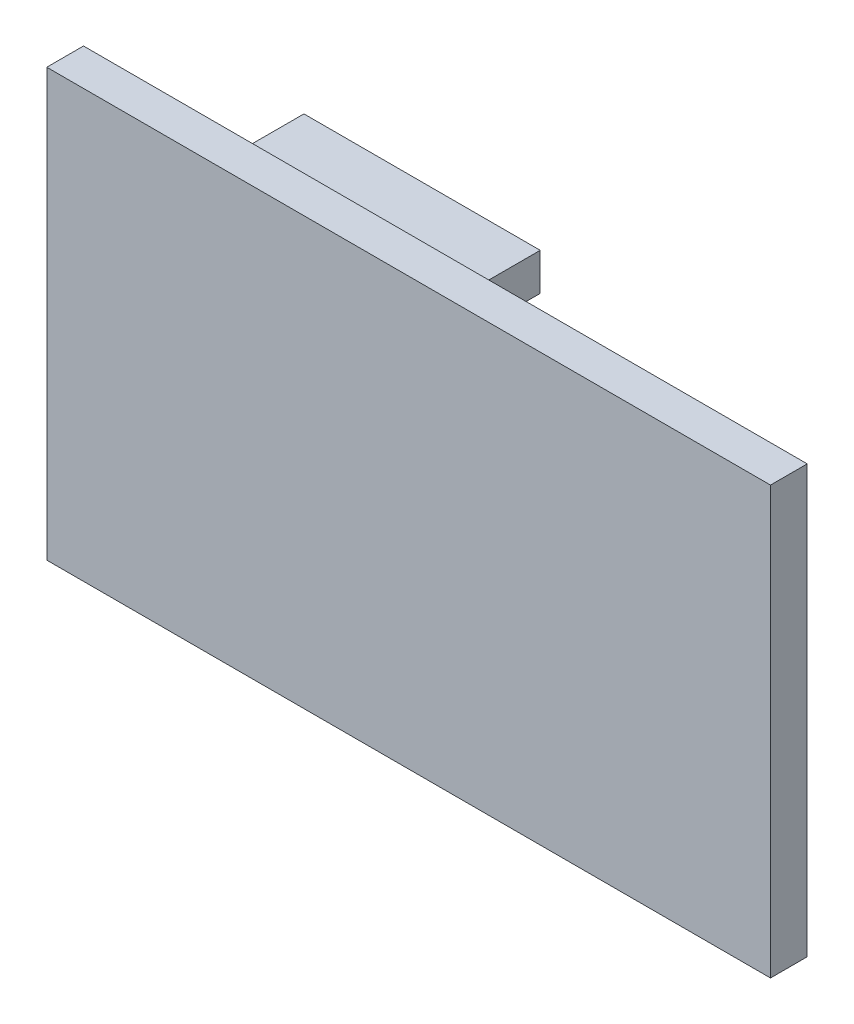
from build123d import *

# Parameters (mm, degrees)
SKETCH1_W           = 98.5
SKETCH1_H           = 58.1
BOSS_EXTRUDE1_DEPTH = 5
SKETCH2_W           = 32.16
SKETCH2_H           = 5.08
BOSS_EXTRUDE2_DEPTH = 10


with BuildPart() as part:
    # Sketch1 → Boss-Extrude1 (new body)
    with BuildSketch(Plane.XY):
        Rectangle(SKETCH1_W, SKETCH1_H)
    extrude(amount=BOSS_EXTRUDE1_DEPTH)

    # Sketch2 → Boss-Extrude2 (add)
    with BuildSketch(Plane(origin=(0, 0, 0), x_dir=(-1, 0, 0), z_dir=(0, 0, -1))):
        with Locations((13.17, 23.51)):
            Rectangle(SKETCH2_W, SKETCH2_H)
    extrude(amount=BOSS_EXTRUDE2_DEPTH)


solid = part.part
